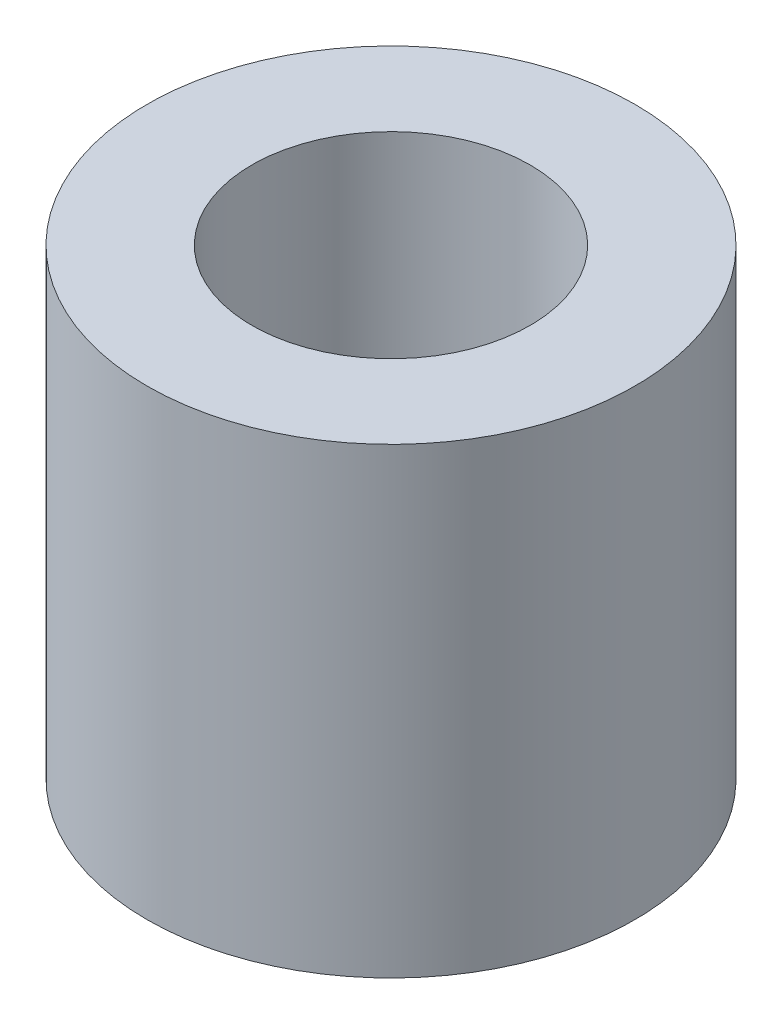
from build123d import *

# Parameters (mm, degrees)
SKETCH1_R           = 21.75
SKETCH1_R_2         = 12.4
BOSS_EXTRUDE1_DEPTH = 20.6


with BuildPart() as part:
    # Sketch1 → Boss-Extrude1 (new, symmetric)
    with BuildSketch(Plane(origin=(0, 0, 0), x_dir=(1, 0, 0), z_dir=(0, 1, 0))):
        with Locations(Location((0, 0, 0), (0, 0, 90))):
            Circle(SKETCH1_R)
        with Locations(Location((0, 0, 0), (0, 0, 90))):
            Circle(SKETCH1_R_2, mode=Mode.SUBTRACT)
    extrude(amount=BOSS_EXTRUDE1_DEPTH, both=True)


solid = part.part
